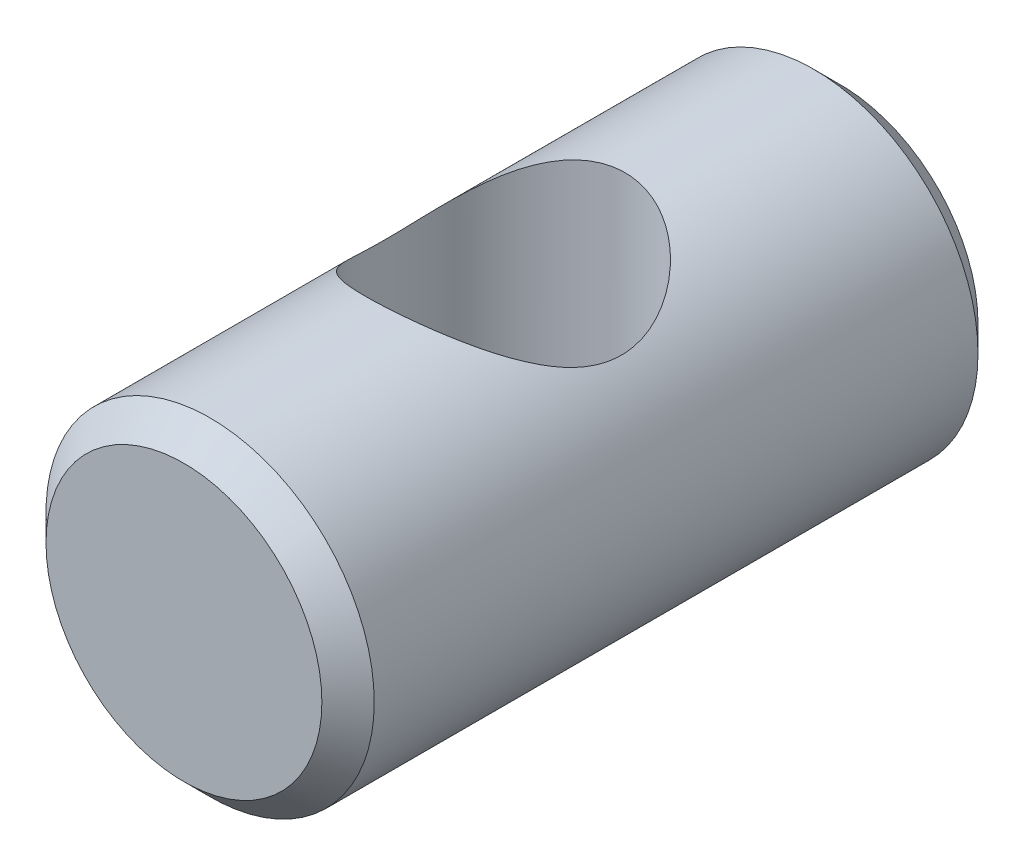
from build123d import *

# Parameters (mm, degrees)
SKETCH1_R           = 4.765
BOSS_EXTRUDE1_DEPTH = 9.525
CHAMFER1_SIZE       = 0.76
CHAMFER2_SIZE       = 0.76
SKETCH2_R           = 3.43
CUT_EXTRUDE1_DEPTH  = 9.525


with BuildPart() as part:
    # Sketch1 → Boss-Extrude1 (new, symmetric)
    with BuildSketch(Plane.XY):
        with Locations(Location((0, 0, 0), (0, 0, 180))):
            Circle(SKETCH1_R)
    extrude(amount=BOSS_EXTRUDE1_DEPTH, both=True)

    # Chamfer1
    chamfer1_edges = [part.edges().sort_by_distance(p)[0] for p in [
        (4.765, 0, 9.525),
    ]]
    chamfer(chamfer1_edges, length=CHAMFER1_SIZE)

    # Chamfer2
    chamfer2_edges = [part.edges().sort_by_distance(p)[0] for p in [
        (4.765, 0, -9.525),
    ]]
    chamfer(chamfer2_edges, length=CHAMFER2_SIZE)

    # Sketch2 → Cut-Extrude1 (cut, symmetric)
    with BuildSketch(Plane(origin=(0, 0, 0), x_dir=(1, 0, 0), z_dir=(0, 1, 0))):
        with Locations(Location((-0.25, 0, 0), (0, 0, 270))):
            Circle(SKETCH2_R)
    extrude(amount=CUT_EXTRUDE1_DEPTH, both=True, mode=Mode.SUBTRACT)


solid = part.part
